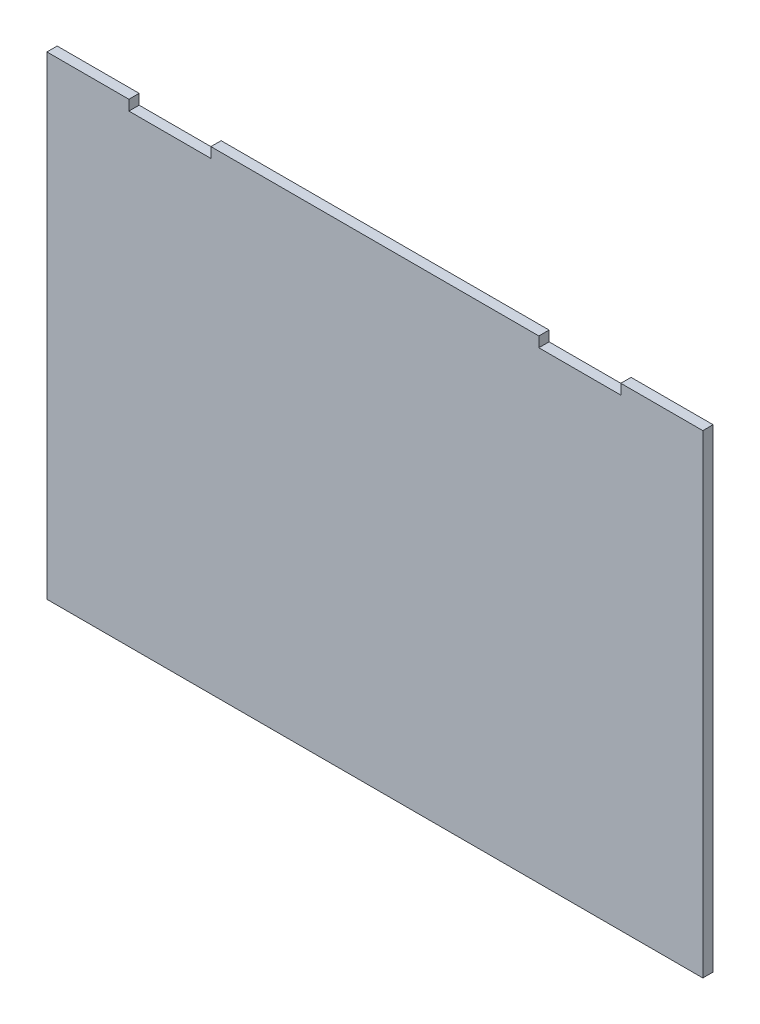
from build123d import *

# Parameters (mm, degrees)
BOSS_EXTRUDE1_DEPTH = 3.175


with BuildPart() as part:
    # Sketch1 → Boss-Extrude1 (new body)
    with BuildSketch(Plane.XY):
        Polygon((-105.228571429, 0), (97.971428571, 0), (97.971428571, 146.8628), (72.571428571, 146.8628), (72.571428571, 143.6878), (47.171428571, 143.6878), (47.171428571, 146.8628), (-54.428571429, 146.8628), (-54.428571429, 143.6878), (-79.828571429, 143.6878), (-79.828571429, 146.8628), (-105.228571429, 146.8628), align=None)
    extrude(amount=BOSS_EXTRUDE1_DEPTH)


solid = part.part
